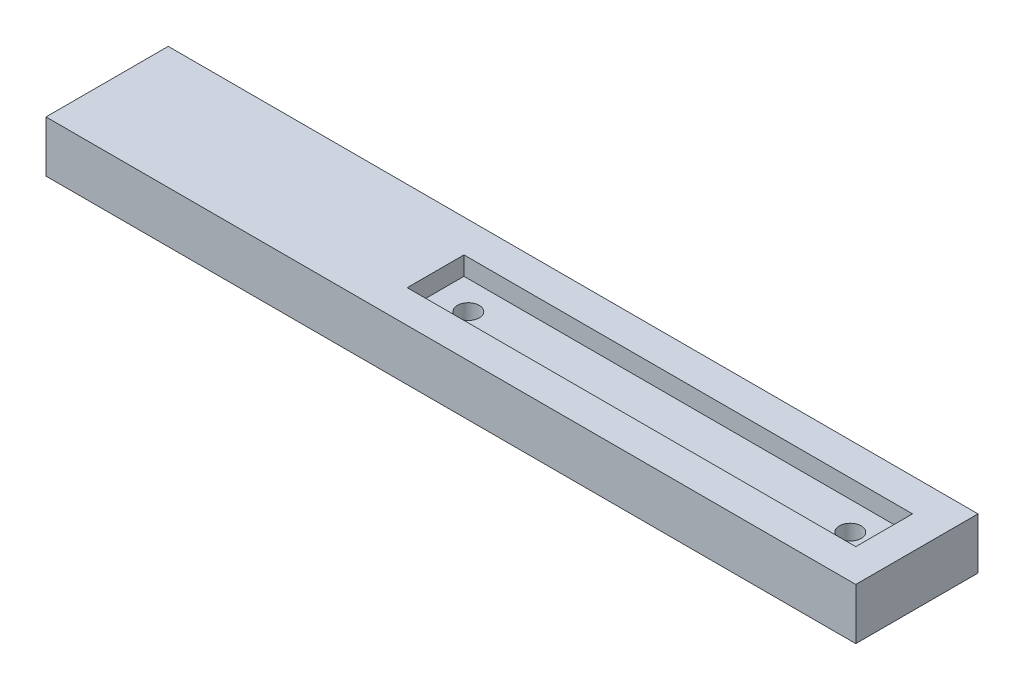
from build123d import *

# Parameters (mm, degrees)
SKETCH1_W           = 74.2
SKETCH1_H           = 11.2
SKETCH1_W_2         = 68.2
SKETCH1_H_2         = 5.2
BOSS_EXTRUDE1_DEPTH = 1.7
SKETCH2_W           = 74.2
SKETCH2_H           = 11.2
BOSS_EXTRUDE2_DEPTH = 3
SKETCH5_R           = 1
CUT_EXTRUDE1_DEPTH  = 3
CUT_EXTRUDE2_DEPTH  = 1.6
SKETCH8_W           = 27.1
SKETCH8_H           = 5.2
BOSS_EXTRUDE3_DEPTH = 1.7


with BuildPart() as part:
    # Sketch1 → Boss-Extrude1 (new body)
    with BuildSketch(Plane(origin=(0, 0, 0), x_dir=(1, 0, 0), z_dir=(0, 1, 0))):
        Rectangle(SKETCH1_W, SKETCH1_H)
        Rectangle(SKETCH1_W_2, SKETCH1_H_2, mode=Mode.SUBTRACT)
    extrude(amount=-BOSS_EXTRUDE1_DEPTH)

    # Sketch2 → Boss-Extrude2 (add)
    with BuildSketch(Plane.XZ.offset(1.7)):
        Rectangle(SKETCH2_W, SKETCH2_H)
    extrude(amount=BOSS_EXTRUDE2_DEPTH)

    # Sketch5 → Cut-Extrude1 (cut)
    with BuildSketch(Plane(origin=(0, -1.7, 0), x_dir=(1, 0, 0), z_dir=(0, 1, 0))):
        with Locations(Location((-4, 0, 0), (0, 0, 270))):
            Circle(SKETCH5_R)
        with Locations(Location((31, 0, 0), (0, 0, 270))):
            Circle(SKETCH5_R)
    extrude(amount=-CUT_EXTRUDE1_DEPTH, mode=Mode.SUBTRACT)

    # Sketch7 → Cut-Extrude2 (cut)
    with BuildSketch(Plane.XZ.offset(4.7)):
        Polygon((-5.15, 1.991858429), (-6.3, 0), (-5.15, -1.991858429), (-2.85, -1.991858429), (-1.7, 0), (-2.85, 1.991858429), align=None)
        Polygon((33.3, 0), (32.15, 1.991858429), (29.85, 1.991858429), (28.7, 0), (29.85, -1.991858429), (32.15, -1.991858429), align=None)
    extrude(amount=-CUT_EXTRUDE2_DEPTH, mode=Mode.SUBTRACT)

    # Sketch8 → Boss-Extrude3 (add)
    with BuildSketch(Plane(origin=(0, -1.7, 0), x_dir=(1, 0, 0), z_dir=(0, 1, 0))):
        with Locations((-20.55, 0)):
            Rectangle(SKETCH8_W, SKETCH8_H)
    extrude(amount=BOSS_EXTRUDE3_DEPTH)


solid = part.part
